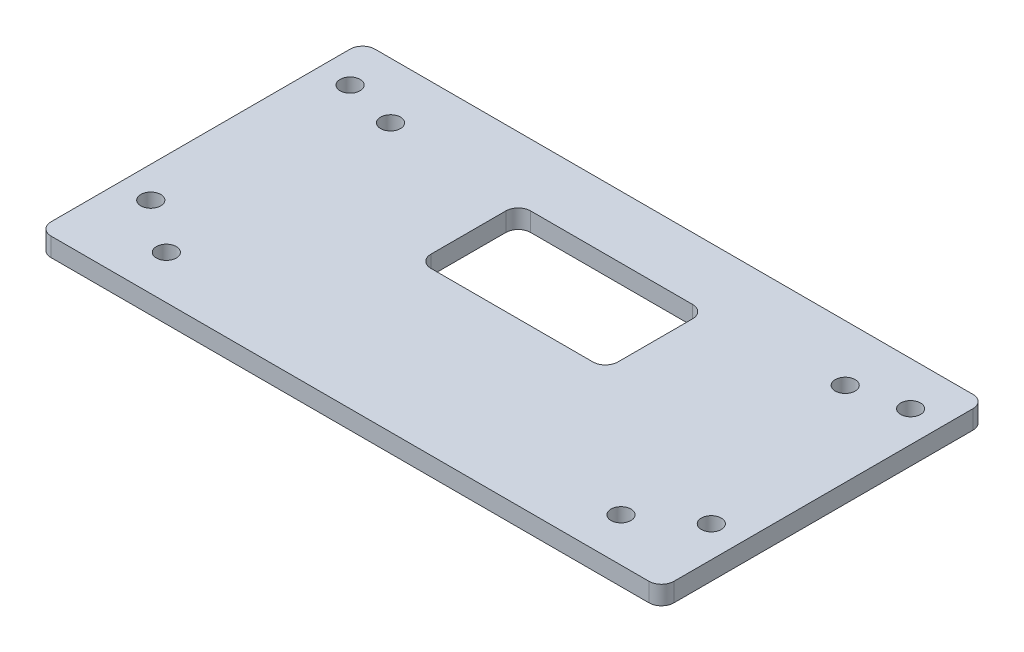
from build123d import *

# Parameters (mm, degrees)
SKETCH_1_W      = 100
SKETCH_1_H      = 52
SKETCH_1_R      = 1.6
EXTRUDE_1_DEPTH = 3
FILLET_1_R      = 2


with BuildPart() as part:
    # 草图1 → 凸台-拉伸1 (new body)
    with BuildSketch(Plane(origin=(0, 0, 0), x_dir=(1, 0, 0), z_dir=(0, 1, 0))):
        Rectangle(SKETCH_1_W, SKETCH_1_H)
        with Locations(Location((-36.5, 17, 0), (0, 0, 270))):
            Circle(SKETCH_1_R, mode=Mode.SUBTRACT)
        with Locations(Location((36.5, 17, 0), (0, 0, 270))):
            Circle(SKETCH_1_R, mode=Mode.SUBTRACT)
        with Locations(Location((36.5, -19, 0), (0, 0, 270))):
            Circle(SKETCH_1_R, mode=Mode.SUBTRACT)
        with Locations(Location((-36.5, -19, 0), (0, 0, 270))):
            Circle(SKETCH_1_R, mode=Mode.SUBTRACT)
        with Locations(Location((-45, 19, 0), (0, 0, 270))):
            Circle(SKETCH_1_R, mode=Mode.SUBTRACT)
        with Locations(Location((45, 19, 0), (0, 0, 90))):
            Circle(SKETCH_1_R, mode=Mode.SUBTRACT)
        with Locations(Location((-45, -13, 0), (0, 0, 270))):
            Circle(SKETCH_1_R, mode=Mode.SUBTRACT)
        with Locations(Location((45, -13, 0), (0, 0, 90))):
            Circle(SKETCH_1_R, mode=Mode.SUBTRACT)
        with BuildLine():
            Line((-13, 0), (13, 0))
            ThreePointArc((13, 0), (14.414213562, 0.585786438), (15, 2))
            Line((15, 2), (15, 14))
            ThreePointArc((15, 14), (14.414213562, 15.414213562), (13, 16))
            Line((13, 16), (-13, 16))
            ThreePointArc((-13, 16), (-14.414213562, 15.414213562), (-15, 14))
            Line((-15, 14), (-15, 2))
            ThreePointArc((-15, 2), (-14.414213562, 0.585786438), (-13, 0))
        make_face(mode=Mode.SUBTRACT)
    extrude(amount=EXTRUDE_1_DEPTH)

    # 圆角1
    fillet_1_edges = [part.edges().sort_by_distance(p)[0] for p in [
        (50, 1.5, 26),
        (-50, 1.5, 26),
        (-50, 1.5, -26),
        (50, 1.5, -26),
    ]]
    fillet(fillet_1_edges, radius=FILLET_1_R)


solid = part.part
